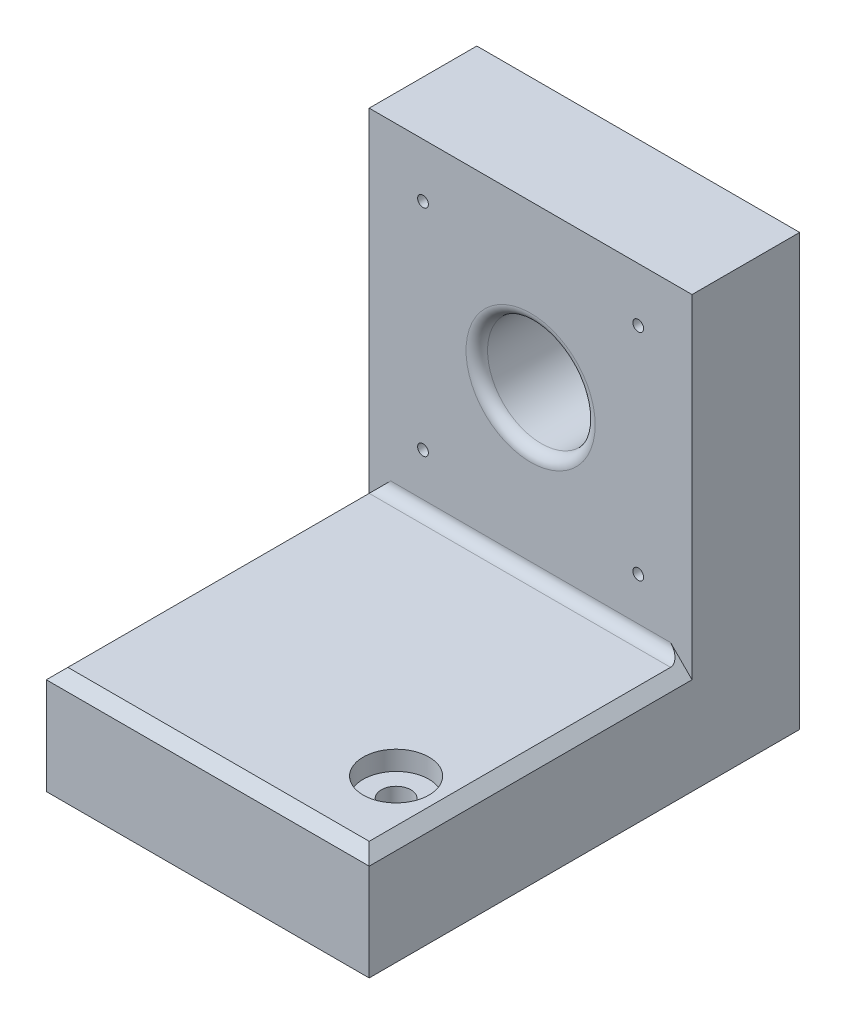
from build123d import *

# Parameters (mm, degrees)
SKETCH1_W           = 60
SKETCH1_H           = 60
BOSS_EXTRUDE1_DEPTH = 20
SKETCH1_3_W         = 60
SKETCH1_3_H         = 20
BOSS_EXTRUDE2_DEPTH = 80
SKETCH3_R           = 10
CUT_EXTRUDE2_DEPTH  = 117.619037897
FILLET2_R           = 2
SKETCH4_R           = 1
CUT_EXTRUDE3_DEPTH  = 10
SKETCH7_R           = 6.12
CUT_EXTRUDE5_DEPTH  = 3.58
SKETCH8_R           = 2.75
CUT_EXTRUDE6_DEPTH  = 107.030261718
CUT_EXTRUDE7_DEPTH  = 60
FILLET7_R           = 2
CUT_EXTRUDE13_DEPTH = 60


with BuildPart() as part:
    # Sketch1 → Boss-Extrude1 (new body)
    with BuildSketch(Plane(origin=(0, 0, 0), x_dir=(1, 0, 0), z_dir=(0, 1, 0))):
        with Locations((30, -30)):
            Rectangle(SKETCH1_W, SKETCH1_H)
    extrude(amount=BOSS_EXTRUDE1_DEPTH)

    # Sketch1<3> → Boss-Extrude2 (add)
    with BuildSketch(Plane(origin=(0, 0, 0), x_dir=(1, 0, 0), z_dir=(0, 1, 0))):
        with Locations((30, 10)):
            Rectangle(SKETCH1_3_W, SKETCH1_3_H)
    extrude(amount=BOSS_EXTRUDE2_DEPTH)

    # Sketch3 → Cut-Extrude2 (cut, through all)
    with BuildSketch(Plane.XY):
        with Locations((30, 50)):
            Circle(SKETCH3_R)
    extrude(amount=-CUT_EXTRUDE2_DEPTH, mode=Mode.SUBTRACT)

    # Fillet2
    fillet2_edges = [part.edges().sort_by_distance(p)[0] for p in [
        (20, 50, -20),
        (20, 50, 0),
    ]]
    fillet(fillet2_edges, radius=FILLET2_R)

    # Sketch4 → Cut-Extrude3 (cut)
    with BuildSketch(Plane.XY):
        with Locations((10, 70)):
            Circle(SKETCH4_R)
        with Locations((50, 70)):
            Circle(SKETCH4_R)
        with Locations((50, 30)):
            Circle(SKETCH4_R)
        with Locations((10, 30)):
            Circle(SKETCH4_R)
    extrude(amount=-CUT_EXTRUDE3_DEPTH, mode=Mode.SUBTRACT)

    # Sketch7 → Cut-Extrude5 (cut)
    with BuildSketch(Plane(origin=(0, 20, 0), x_dir=(1, 0, 0), z_dir=(0, 1, 0))):
        with Locations((50, -45)):
            Circle(SKETCH7_R)
    extrude(amount=-CUT_EXTRUDE5_DEPTH, mode=Mode.SUBTRACT)

    # Sketch8 → Cut-Extrude6 (cut, through all)
    with BuildSketch(Plane(origin=(0, 16.42, 0), x_dir=(1, 0, 0), z_dir=(0, 1, 0))):
        with Locations((50, -45)):
            Circle(SKETCH8_R)
    extrude(amount=-CUT_EXTRUDE6_DEPTH, mode=Mode.SUBTRACT)

    # Sketch9 → Cut-Extrude7 (cut)
    with BuildSketch(Plane.XY.offset(60)):
        Polygon((0, 20), (2, 20), (0, 18), align=None)
        Polygon((60, 20), (58, 20), (60, 18), align=None)
    extrude(amount=-CUT_EXTRUDE7_DEPTH, mode=Mode.SUBTRACT)

    # Fillet7
    fillet7_edges = [part.edges().sort_by_distance(p)[0] for p in [
        (30, 20, 0),
    ]]
    fillet(fillet7_edges, radius=FILLET7_R)

    # Sketch11 → Cut-Extrude13 (cut)
    with BuildSketch(Plane(origin=(60, 0, 0), x_dir=(0, 0, -1), z_dir=(1, 0, 0))):
        Polygon((-60, 20), (-58, 20), (-60, 18), align=None)
    extrude(amount=-CUT_EXTRUDE13_DEPTH, mode=Mode.SUBTRACT)


solid = part.part
